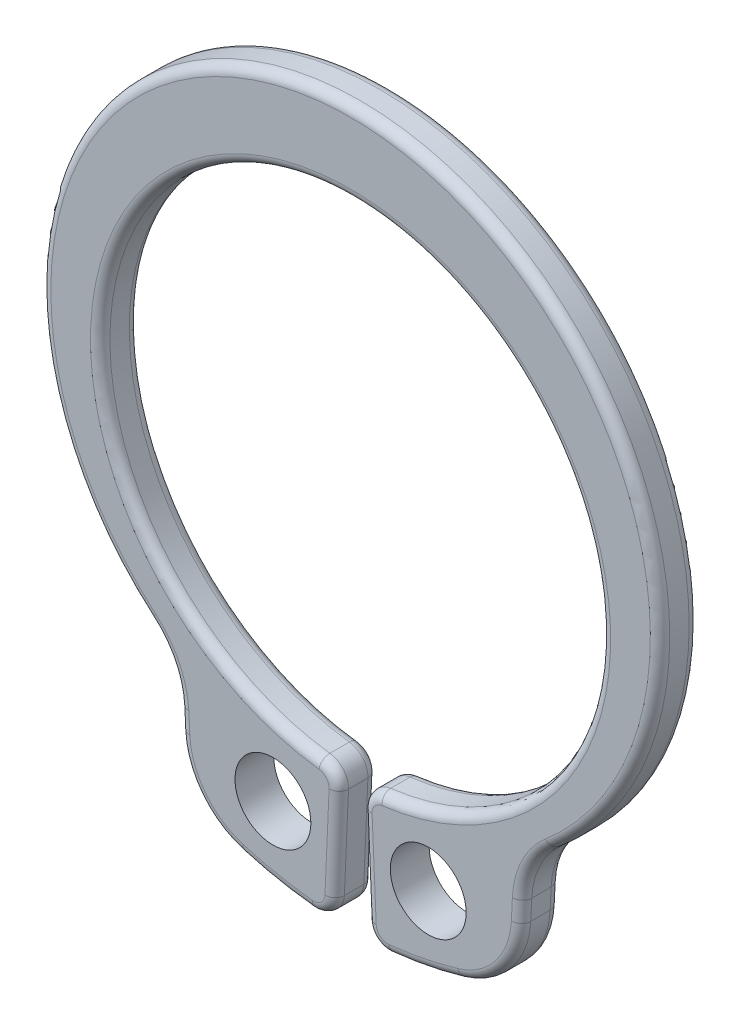
from build123d import *

# Parameters (mm, degrees)
SKETCH2_R           = 0.9775
BOSS_EXTRUDE1_DEPTH = 0.5
FILLET1_R           = 2.17738962
FILLET2_R           = 0.544347405
FILLET3_R           = 0.25


with BuildPart() as part:
    # Sketch2 → Boss-Extrude1 (new, symmetric)
    with BuildSketch(Plane.XY):
        with BuildLine():
            Line((-4.323292557, -8.972199716), (-4.466412125, -6.025044625))
            ThreePointArc((-4.466412125, -6.025044625), (-7.622020124, 2.913838976), (0, 8.55))
            Line((0, 8.55), (0, 6.45))
            ThreePointArc((0, 6.45), (-6.448465075, 0.140706008), (-0.281345049, -6.443861029))
            Line((-0.281345049, -6.443861029), (-0.434426382, -9.95))
            ThreePointArc((-0.434426382, -9.95), (-2.428578952, -9.658842092), (-4.323292557, -8.972199716))
        make_face()
        with Locations((-2.000692755, -7.957071103)):
            Circle(SKETCH2_R, mode=Mode.SUBTRACT)
    extrude(amount=BOSS_EXTRUDE1_DEPTH, both=True)

    # Fillet1
    fillet1_edges = [part.edges().sort_by_distance(p)[0] for p in [
        (-4.323292557, -8.972199716, 0),
        (-4.466412125, -6.025044625, 0),
    ]]
    fillet(fillet1_edges, radius=FILLET1_R)

    # Fillet2
    fillet2_edges = [part.edges().sort_by_distance(p)[0] for p in [
        (-0.281345049, -6.443861029, 0),
        (-0.434426382, -9.95, 0),
    ]]
    fillet(fillet2_edges, radius=FILLET2_R)

    # Mirror1: part across plane


with BuildPart() as part_1:
    add(part.part)
    add(part.part.mirror(Plane(origin=(0, 8.55, 0.5), x_dir=(0, 0, 1), z_dir=(-1, 0, 0))))

    # Fillet3
    fillet3_edges = [part_1.edges().sort_by_distance(p)[0] for p in [
        (-1.931473241, -9.770395969, -0.5),
        (-1.931473241, -9.770395969, 0.5),
        (-4.404537548, -7.299181883, -0.5),
        (-3.929902005, -8.80365027, -0.5),
        (-4.404537548, -7.299181883, 0.5),
        (-3.929902005, -8.80365027, 0.5),
        (-4.637548044, -6.179510223, -0.5),
        (-4.637548044, -6.179510223, 0.5),
        (-0.357079546, -8.178466205, -0.5),
        (-0.357079546, -8.178466205, 0.5),
        (6.438094003, 0.391721342, -0.5),
        (-0.432641038, -6.590904204, -0.5),
        (-0.597829357, -9.778495064, -0.5),
        (0, 6.45, 0.5),
        (-0.432641038, -6.590904204, 0.5),
        (7.478985284, 3.337750467, 0.5),
        (-0.597829357, -9.778495064, 0.5),
        (0.357079546, -8.178466205, -0.5),
        (4.404537548, -7.299181883, -0.5),
        (1.931473241, -9.770395969, -0.5),
        (4.404537548, -7.299181883, 0.5),
        (1.931473241, -9.770395969, 0.5),
        (0.357079546, -8.178466205, 0.5),
        (3.929902005, -8.80365027, 0.5),
        (3.929902005, -8.80365027, -0.5),
        (4.637548044, -6.179510223, 0.5),
        (4.637548044, -6.179510223, -0.5),
        (0.597829357, -9.778495064, 0.5),
        (0.597829357, -9.778495064, -0.5),
        (0.432641038, -6.590904204, 0.5),
        (0.432641038, -6.590904204, -0.5),
        (7.478985284, 3.337750467, -0.5),
    ]]
    fillet(fillet3_edges, radius=FILLET3_R)


solid = part_1.part
